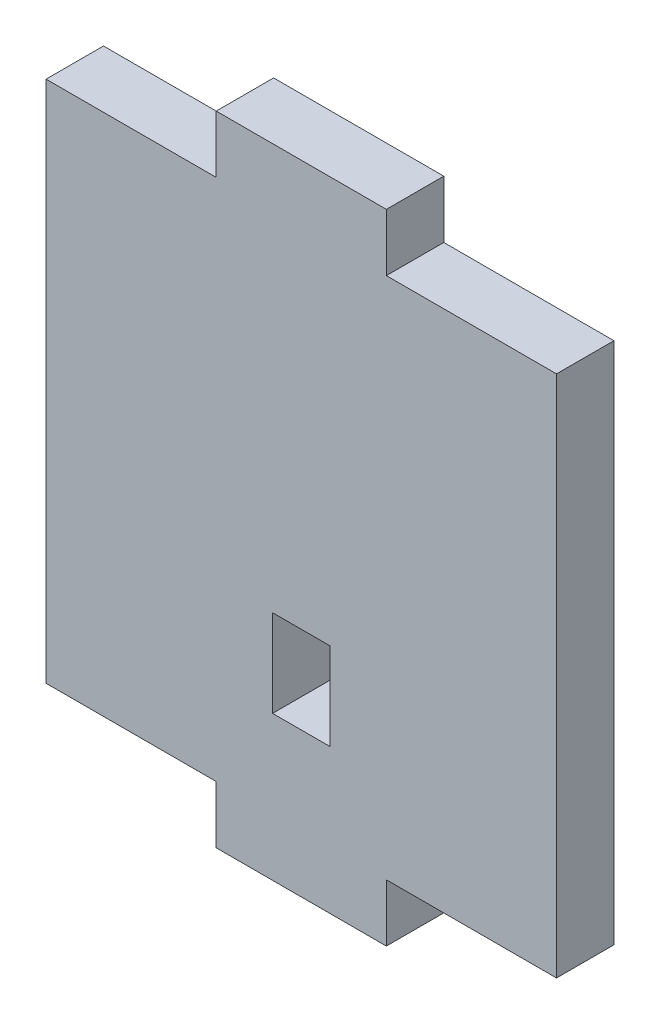
from build123d import *

# Parameters (mm, degrees)
SKETCH1_W           = 9
SKETCH1_H           = 13.666666666
BOSS_EXTRUDE1_DEPTH = 9


with BuildPart() as part:
    # Sketch1 → Boss-Extrude1 (new body)
    with BuildSketch(Plane.XY):
        Polygon((26.666666667, 9), (26.666666667, 0), (53.333333333, 0), (53.333333333, 9), (80, 9), (80, 91), (53.333333333, 91), (53.333333333, 100), (26.666666667, 100), (26.666666667, 91), (0, 91), (0, 9), align=None)
        with Locations((40, 29.5)):
            Rectangle(SKETCH1_W, SKETCH1_H, mode=Mode.SUBTRACT)
    extrude(amount=BOSS_EXTRUDE1_DEPTH)


solid = part.part
